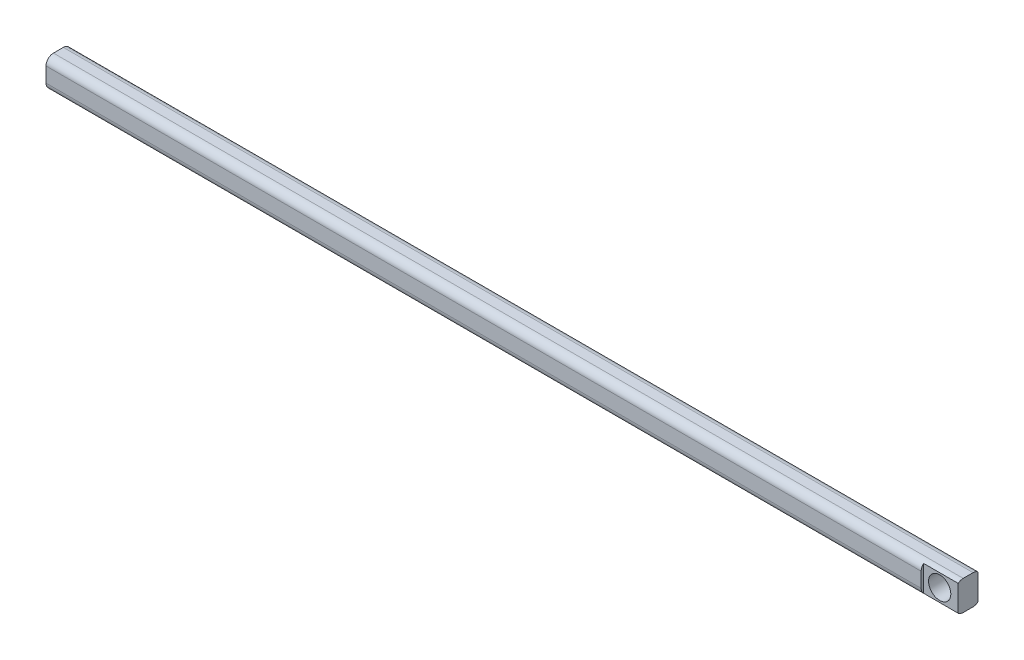
from build123d import *

# Parameters (mm, degrees)
CROQUIS1_W                 = 37.5
CROQUIS1_H                 = 30
SALIENTE_EXTRUIR1_DEPTH    = 15
CROQUIS2_R                 = 2.1
SALIENTE_EXTRUIR2_DEPTH    = 1
SALIENTE_EXTRUIR3_DEPTH    = 35
CROQUIS5_W                 = 18
CROQUIS5_H                 = 12
CROQUIS5_R                 = 4.5
SALIENTE_EXTRUIR4_DEPTH    = 5
CROQUIS6_W                 = 1
CROQUIS6_H                 = 12
CORTAR_EXTRUIR2_DEPTH      = 14
REDONDEO2_R                = 3
CORTAR_EXTRUIR3_DEPTH      = 78.447159406
CORTAR_EXTRUIR3_DEPTH_BACK = 78.447159406
CROQUIS7_OUTSIDE_W         = 123.972
CROQUIS7_OUTSIDE_H         = 74.472
CROQUIS7_OUTSIDE_W_2       = 24.163279834
CROQUIS7_OUTSIDE_H_2       = 36.211204922
SALIENTE_EXTRUIR5_DEPTH    = 350


with BuildPart() as part:
    # Croquis1 → Saliente-Extruir1 (new body)
    with BuildSketch(Plane.XY):
        Rectangle(CROQUIS1_W, CROQUIS1_H)
    extrude(amount=SALIENTE_EXTRUIR1_DEPTH)

    # Croquis2 → Saliente-Extruir2 (add)
    # profile 1 of 3: a face of its own
    with BuildSketch(Plane.XY):
        with BuildLine():
            Line((-18.75, 3.7), (-26.75, 3.7))
            ThreePointArc((-26.75, 3.7), (-27.457106781, 3.407106781), (-27.75, 2.7))
            Line((-27.75, 2.7), (-27.75, -2.7))
            ThreePointArc((-27.75, -2.7), (-27.457106781, -3.407106781), (-26.75, -3.7))
            Line((-26.75, -3.7), (-18.75, -3.7))
            Line((-18.75, -3.7), (-18.75, 3.7))
        make_face()
        with Locations((-23.25, 0)):
            Circle(CROQUIS2_R, mode=Mode.SUBTRACT)
    # profile 2 of 3: a face of its own
    with BuildSketch(Plane.XY):
        with BuildLine():
            Line((-10, 15), (10, 15))
            Line((10, 15), (10, 24))
            ThreePointArc((10, 24), (9.707106781, 24.707106781), (9, 25))
            Line((9, 25), (-9, 25))
            ThreePointArc((-9, 25), (-9.707106781, 24.707106781), (-10, 24))
            Line((-10, 24), (-10, 15))
        make_face()
        with Locations((-5.5, 20)):
            Circle(CROQUIS2_R, mode=Mode.SUBTRACT)
        with Locations((5.5, 20)):
            Circle(CROQUIS2_R, mode=Mode.SUBTRACT)
    # profile 3 of 3: a face of its own
    with BuildSketch(Plane.XY):
        with BuildLine():
            Line((-9, -25), (9, -25))
            ThreePointArc((9, -25), (9.707106781, -24.707106781), (10, -24))
            Line((10, -24), (10, -15))
            Line((10, -15), (-10, -15))
            Line((-10, -15), (-10, -24))
            ThreePointArc((-10, -24), (-9.707106781, -24.707106781), (-9, -25))
        make_face()
        with Locations(Location((5.5, -20, 0), (0, 0, 180))):
            Circle(CROQUIS2_R, mode=Mode.SUBTRACT)
        with Locations(Location((-5.5, -20, 0), (0, 0, 180))):
            Circle(CROQUIS2_R, mode=Mode.SUBTRACT)
    extrude(amount=SALIENTE_EXTRUIR2_DEPTH)

    # Croquis3 → Saliente-Extruir3 (add)
    with BuildSketch(Plane(origin=(18.75, 0, 0), x_dir=(0, 0, -1), z_dir=(1, 0, 0))):
        with BuildLine():
            Line((-10.5, -12.5), (-4.5, -12.5))
            ThreePointArc((-4.5, -12.5), (-2.378679656, -11.621320344), (-1.5, -9.5))
            Line((-1.5, -9.5), (-1.5, 9.5))
            ThreePointArc((-1.5, 9.5), (-2.378679656, 11.621320344), (-4.5, 12.5))
            Line((-4.5, 12.5), (-10.5, 12.5))
            ThreePointArc((-10.5, 12.5), (-12.621320344, 11.621320344), (-13.5, 9.5))
            Line((-13.5, 9.5), (-13.5, -9.5))
            ThreePointArc((-13.5, -9.5), (-12.621320344, -11.621320344), (-10.5, -12.5))
        make_face()
    extrude(amount=SALIENTE_EXTRUIR3_DEPTH)

    # Croquis5 → Saliente-Extruir4 (add, symmetric)
    with BuildSketch(Plane.XY.offset(7.5)):
        with Locations((62.75, 0)):
            Rectangle(CROQUIS5_W, CROQUIS5_H)
        with Locations((64.25, 0)):
            Circle(CROQUIS5_R, mode=Mode.SUBTRACT)
    extrude(amount=SALIENTE_EXTRUIR4_DEPTH, both=True)

    # Croquis6 → Cortar-Extruir2 (cut)
    with BuildSketch(Plane(origin=(71.75, 0, 0), x_dir=(0, 0, -1), z_dir=(1, 0, 0))):
        with Locations((-12, 0)):
            Rectangle(CROQUIS6_W, CROQUIS6_H)
        with Locations((-3, 0)):
            Rectangle(CROQUIS6_W, CROQUIS6_H)
    extrude(amount=-CORTAR_EXTRUIR2_DEPTH, mode=Mode.SUBTRACT)

    # Redondeo2
    redondeo2_edges = [part.edges().sort_by_distance(p)[0] for p in [
        (55.75, -6, 12.5),
        (55.75, -6, 2.5),
        (55.75, 6, 2.5),
        (55.75, 6, 12.5),
    ]]
    fillet(redondeo2_edges, radius=REDONDEO2_R)

    # Croquis7 outside → Cortar-Extruir3 (cut, two sides: drawn at the far end of the back side and taken through both)
    with BuildSketch(Plane.XY.offset(15).offset(-CORTAR_EXTRUIR3_DEPTH_BACK)):
        with Locations((22, 0)):
            Rectangle(CROQUIS7_OUTSIDE_W, CROQUIS7_OUTSIDE_H)
        with Locations((65.831639917, -3.105602461)):
            Rectangle(CROQUIS7_OUTSIDE_W_2, CROQUIS7_OUTSIDE_H_2, mode=Mode.SUBTRACT)
    extrude(amount=CORTAR_EXTRUIR3_DEPTH + CORTAR_EXTRUIR3_DEPTH_BACK, mode=Mode.SUBTRACT)

    # Croquis10 → Saliente-Extruir5 (add)
    with BuildSketch(Plane.ZY.offset(-53.75)):
        with BuildLine():
            Line((5.5, -6), (9.5, -6))
            ThreePointArc((9.5, -6), (11.621320344, -5.121320344), (12.5, -3))
            Line((12.5, -3), (12.5, 3))
            ThreePointArc((12.5, 3), (11.621320344, 5.121320344), (9.5, 6))
            Line((9.5, 6), (5.5, 6))
            ThreePointArc((5.5, 6), (3.378679656, 5.121320344), (2.5, 3))
            Line((2.5, 3), (2.5, -3))
            ThreePointArc((2.5, -3), (3.378679656, -5.121320344), (5.5, -6))
        make_face()
    extrude(amount=SALIENTE_EXTRUIR5_DEPTH)


solid = part.part
